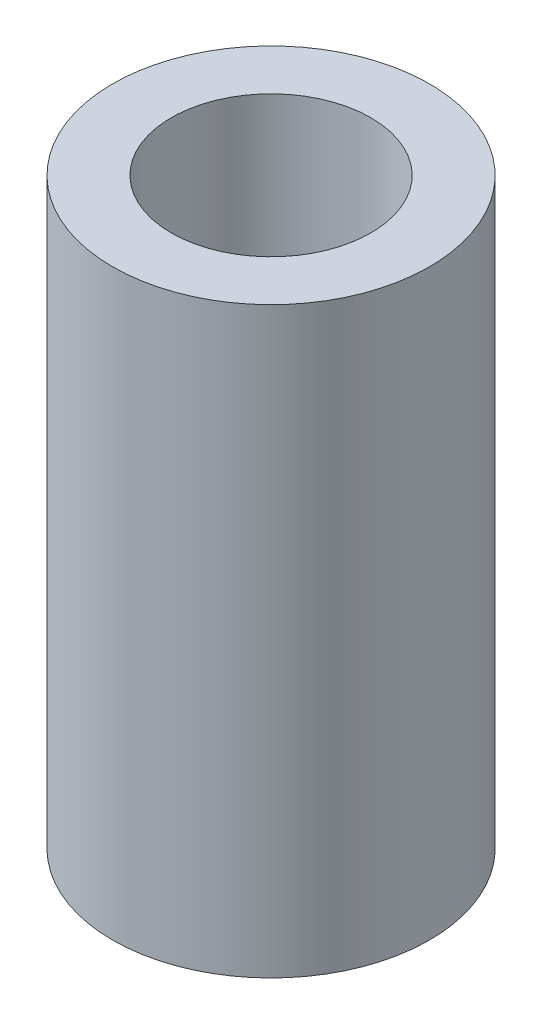
from build123d import *

# Parameters (mm, degrees)
SKETCH1_R           = 3.175
SKETCH1_R_2         = 2
BOSS_EXTRUDE1_DEPTH = 11.684


with BuildPart() as part:
    # Sketch1 → Boss-Extrude1 (new body)
    with BuildSketch(Plane(origin=(0, 0, 0), x_dir=(1, 0, 0), z_dir=(0, 1, 0))):
        with Locations(Location((0, 0, 0), (0, 0, 270))):
            Circle(SKETCH1_R)
        with Locations(Location((0, 0, 0), (0, 0, 270))):
            Circle(SKETCH1_R_2, mode=Mode.SUBTRACT)
    extrude(amount=-BOSS_EXTRUDE1_DEPTH)


solid = part.part
